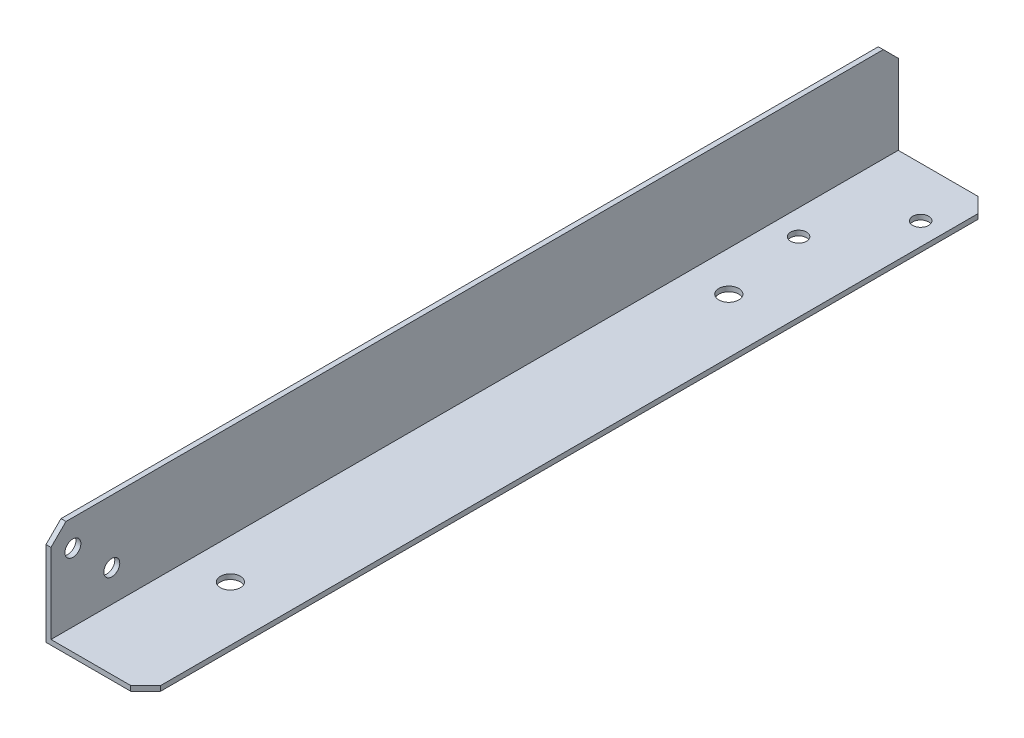
from build123d import *

# Parameters (mm, degrees)
BASE_DEPTH                      = 170
CHAMFEREDGES_SIZE               = 3
F_4_0_4_CABLE_TIE_HOLES_D       = 4
F_3_1_3_1_CABLECHAINSIDEHOLES_D = 3.2
F_3_2_3_2_CARRIAGESIDE_D        = 3.2


with BuildPart() as part:
    # Sketch1 → Base (new body)
    with BuildSketch(Plane.XY):
        Polygon((0, 0), (20, 0), (20, 1), (1, 1), (1, 20), (0, 20), align=None)
    extrude(amount=BASE_DEPTH)

    # ChamferEdges
    chamferedges_edges = [part.edges().sort_by_distance(p)[0] for p in [
        (20, 0.5, 170),
        (0.5, 20, 170),
        (0.5, 20, 0),
        (20, 0.5, 0),
    ]]
    chamfer(chamferedges_edges, length=CHAMFEREDGES_SIZE)

    # Ø4.0 (4) Cable tie Holes (through all)
    with Locations(Plane(origin=(0, 1, 0), x_dir=(1, 0, 0), z_dir=(0, 1, 0))):
        with Locations((9, -42), (9, -142)):
            Hole(F_4_0_4_CABLE_TIE_HOLES_D / 2)

    # Ø3.1 (3.1) CableChainSideHoles (through all)
    with Locations(Plane(origin=(1, 0, 0), x_dir=(0, 0, -1), z_dir=(1, 0, 0))):
        with Locations((-165.6, 14.68), (-157.8, 7.38)):
            Hole(F_3_1_3_1_CABLECHAINSIDEHOLES_D / 2)

    # Ø3.2 (3.2) CarriageSide (through all)
    with Locations(Plane(origin=(0, 1, 0), x_dir=(1, 0, 0), z_dir=(0, 1, 0))):
        with Locations((15.5, -10), (6, -25)):
            Hole(F_3_2_3_2_CARRIAGESIDE_D / 2)


solid = part.part
